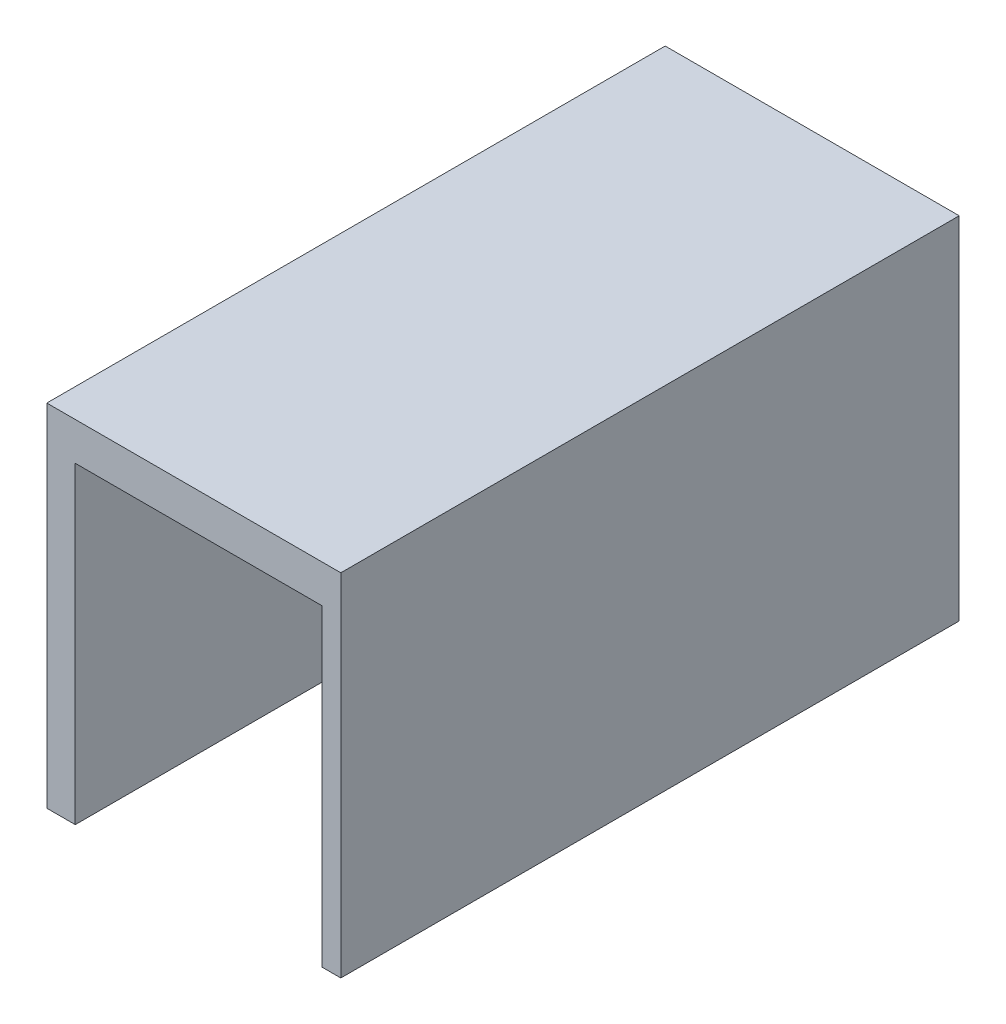
from build123d import *

# Parameters (mm, degrees)
FRONT_PROFILE_DEPTH  = 65.2
SKETCH3_W            = 65.2
SKETCH3_H            = 37
SKETCH3_W_2          = 63.86
SKETCH3_H_2          = 35.66
HOUSING_SNAPON_DEPTH = 1


with BuildPart() as part:
    # Sketch2 → Front Profile (new body)
    with BuildSketch(Plane.XY):
        Polygon((-13, -16.5), (-15, -16.5), (-15, 20.5), (15, 20.5), (15, -16.5), (13, -16.5), (13, 16.5), (-13, 16.5), align=None)
    extrude(amount=FRONT_PROFILE_DEPTH)

    # Sketch3 → Housing SnapOn (add)
    with BuildSketch(Plane.ZY.offset(15)):
        with Locations((32.6, 2)):
            Rectangle(SKETCH3_W, SKETCH3_H)
        with Locations((32.6, 2)):
            Rectangle(SKETCH3_W_2, SKETCH3_H_2, mode=Mode.SUBTRACT)
    extrude(amount=HOUSING_SNAPON_DEPTH)


solid = part.part
